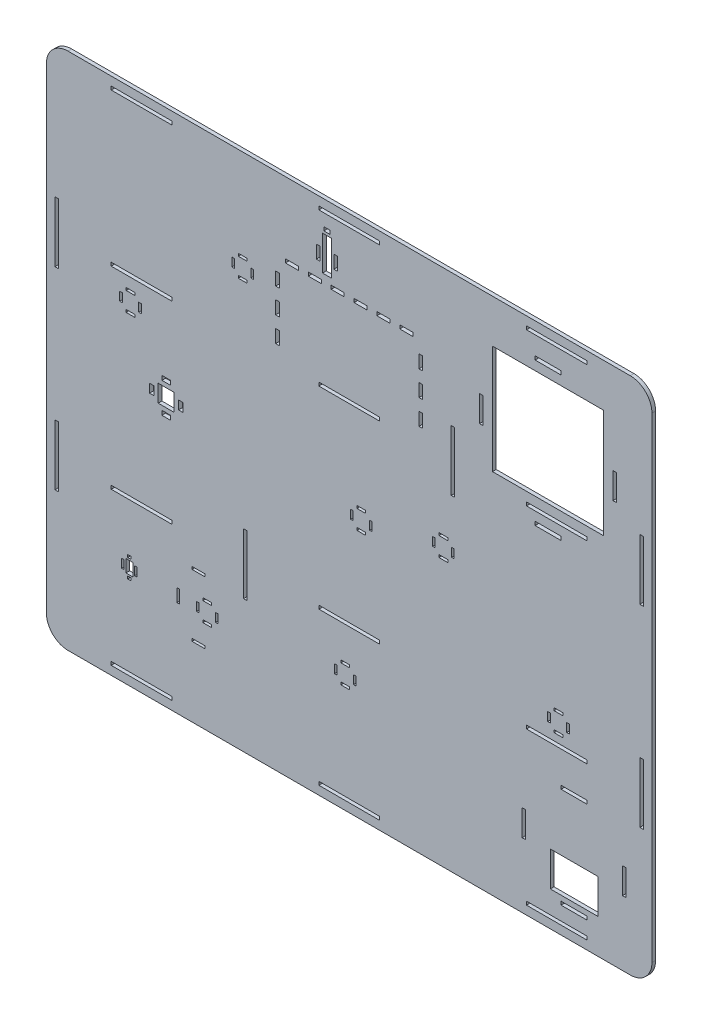
from build123d import *

# Parameters (mm, degrees)
SKETCH1_W           = 4.2
SKETCH1_H           = 15.1
SKETCH1_W_2         = 70
SKETCH1_H_2         = 4
SKETCH1_W_3         = 4
SKETCH1_H_3         = 70
SKETCH1_W_4         = 15.1
SKETCH1_H_4         = 4.2
SKETCH1_W_5         = 7.1
SKETCH1_W_6         = 10.1
SKETCH1_H_5         = 40
SKETCH1_W_7         = 30
SKETCH1_H_6         = 30
SKETCH1_W_8         = 55
SKETCH1_W_9         = 3
SKETCH1_H_7         = 10
SKETCH1_H_8         = 3
SKETCH1_W_10        = 5
SKETCH1_W_11        = 10
SKETCH1_H_9         = 5
SKETCH1_W_12        = 18.5
SKETCH1_H_10        = 20
SKETCH1_W_13        = 8
SKETCH1_H_11        = 14.5
SKETCH1_W_14        = 15
SKETCH1_H_12        = 15
SKETCH1_W_15        = 4.3
SKETCH1_H_13        = 30.1
SKETCH1_W_16        = 30.1
SKETCH1_H_14        = 4.3
SKETCH1_W_17        = 128.6
SKETCH1_H_15        = 125.6333
BOSS_EXTRUDE1_DEPTH = 4.3


with BuildPart() as part:
    # Sketch1 → Boss-Extrude1 (new body)
    with BuildSketch(Plane.XY):
        with BuildLine():
            Line((-325, -300), (325, -300))
            ThreePointArc((325, -300), (342.67766953, -292.67766953), (350, -275))
            Line((350, -275), (350, 275))
            ThreePointArc((350, 275), (342.67766953, 292.67766953), (325, 300))
            Line((325, 300), (-325, 300))
            ThreePointArc((-325, 300), (-342.67766953, 292.67766953), (-350, 275))
            Line((-350, 275), (-350, -275))
            ThreePointArc((-350, -275), (-342.67766953, -292.67766953), (-325, -300))
        make_face()
        with Locations((82.85, 192.32)):
            Rectangle(SKETCH1_W, SKETCH1_H, mode=Mode.SUBTRACT)
        with Locations((-240, -288)):
            Rectangle(SKETCH1_W_2, SKETCH1_H_2, mode=Mode.SUBTRACT)
        with Locations((338, -111.6666)):
            Rectangle(SKETCH1_W_3, SKETCH1_H_3, mode=Mode.SUBTRACT)
        with Locations((338, 111.6667)):
            Rectangle(SKETCH1_W_3, SKETCH1_H_3, mode=Mode.SUBTRACT)
        with Locations((0, -288)):
            Rectangle(SKETCH1_W_2, SKETCH1_H_2, mode=Mode.SUBTRACT)
        with Locations((240, -288)):
            Rectangle(SKETCH1_W_2, SKETCH1_H_2, mode=Mode.SUBTRACT)
        with Locations((-338, 111.6667)):
            Rectangle(SKETCH1_W_3, SKETCH1_H_3, mode=Mode.SUBTRACT)
        with Locations((-338, -111.6666)):
            Rectangle(SKETCH1_W_3, SKETCH1_H_3, mode=Mode.SUBTRACT)
        with Locations((120, 111.6667)):
            Rectangle(SKETCH1_W_3, SKETCH1_H_3, mode=Mode.SUBTRACT)
        with Locations((-120, -111.6667)):
            Rectangle(SKETCH1_W_3, SKETCH1_H_3, mode=Mode.SUBTRACT)
        with Locations((0, 111.6667)):
            Rectangle(SKETCH1_W_2, SKETCH1_H_2, mode=Mode.SUBTRACT)
        with Locations((-240, 111.6667)):
            Rectangle(SKETCH1_W_2, SKETCH1_H_2, mode=Mode.SUBTRACT)
        with Locations((240, 111.6667)):
            Rectangle(SKETCH1_W_2, SKETCH1_H_2, mode=Mode.SUBTRACT)
        with Locations((-240, -111.6667)):
            Rectangle(SKETCH1_W_2, SKETCH1_H_2, mode=Mode.SUBTRACT)
        with Locations((0, -111.6667)):
            Rectangle(SKETCH1_W_2, SKETCH1_H_2, mode=Mode.SUBTRACT)
        with Locations((240, -111.6667)):
            Rectangle(SKETCH1_W_2, SKETCH1_H_2, mode=Mode.SUBTRACT)
        with Locations((-240, 288)):
            Rectangle(SKETCH1_W_2, SKETCH1_H_2, mode=Mode.SUBTRACT)
        with Locations((0, 288)):
            Rectangle(SKETCH1_W_2, SKETCH1_H_2, mode=Mode.SUBTRACT)
        with Locations((240, 288)):
            Rectangle(SKETCH1_W_2, SKETCH1_H_2, mode=Mode.SUBTRACT)
        with Locations((82.85, 163.54)):
            Rectangle(SKETCH1_W, SKETCH1_H, mode=Mode.SUBTRACT)
        with Locations((82.85, 134.76)):
            Rectangle(SKETCH1_W, SKETCH1_H, mode=Mode.SUBTRACT)
        with Locations((-82.85, 134.76)):
            Rectangle(SKETCH1_W, SKETCH1_H, mode=Mode.SUBTRACT)
        with Locations((-82.85, 163.54)):
            Rectangle(SKETCH1_W, SKETCH1_H, mode=Mode.SUBTRACT)
        with Locations((-82.85, 192.32)):
            Rectangle(SKETCH1_W, SKETCH1_H, mode=Mode.SUBTRACT)
        with Locations((-66.1, 215.7)):
            Rectangle(SKETCH1_W_4, SKETCH1_H_4, mode=Mode.SUBTRACT)
        with Locations((-39.66, 215.7)):
            Rectangle(SKETCH1_W_4, SKETCH1_H_4, mode=Mode.SUBTRACT)
        with Locations((-13.22, 215.7)):
            Rectangle(SKETCH1_W_4, SKETCH1_H_4, mode=Mode.SUBTRACT)
        with Locations((13.22, 215.7)):
            Rectangle(SKETCH1_W_4, SKETCH1_H_4, mode=Mode.SUBTRACT)
        with Locations((39.66, 215.7)):
            Rectangle(SKETCH1_W_4, SKETCH1_H_4, mode=Mode.SUBTRACT)
        with Locations((66.1, 215.7)):
            Rectangle(SKETCH1_W_4, SKETCH1_H_4, mode=Mode.SUBTRACT)
        with Locations((-15.55, 242.85)):
            Rectangle(SKETCH1_W, SKETCH1_H, mode=Mode.SUBTRACT)
        with Locations((-35.85, 242.85)):
            Rectangle(SKETCH1_W, SKETCH1_H, mode=Mode.SUBTRACT)
        with Locations((-25.7, 270)):
            Rectangle(SKETCH1_W_5, SKETCH1_H_4, mode=Mode.SUBTRACT)
        with Locations((-25.7, 244.9)):
            Rectangle(SKETCH1_W_6, SKETCH1_H_5, mode=Mode.SUBTRACT)
        with Locations((260, -268)):
            Rectangle(SKETCH1_W_7, SKETCH1_H_2, mode=Mode.SUBTRACT)
        with Locations((202, -210)):
            Rectangle(SKETCH1_W_3, SKETCH1_H_6, mode=Mode.SUBTRACT)
        with Locations((260, -152)):
            Rectangle(SKETCH1_W_7, SKETCH1_H_2, mode=Mode.SUBTRACT)
        with Locations((318, -210)):
            Rectangle(SKETCH1_W_3, SKETCH1_H_6, mode=Mode.SUBTRACT)
        with Locations((260, -240)):
            Rectangle(SKETCH1_W_8, SKETCH1_H_5, mode=Mode.SUBTRACT)
        with Locations((-246.5, -181.7)):
            Rectangle(SKETCH1_W_9, SKETCH1_H_7, mode=Mode.SUBTRACT)
        with Locations((-254, -192.45)):
            Rectangle(SKETCH1_W_3, SKETCH1_H_8, mode=Mode.SUBTRACT)
        with Locations((-261.5, -181.7)):
            Rectangle(SKETCH1_W_9, SKETCH1_H_7, mode=Mode.SUBTRACT)
        with Locations((-254, -170.95)):
            Rectangle(SKETCH1_W_3, SKETCH1_H_8, mode=Mode.SUBTRACT)
        with Locations((-194.7, 9.66)):
            Rectangle(SKETCH1_W_10, SKETCH1_H_7, mode=Mode.SUBTRACT)
        with Locations((-228.2, 9.66)):
            Rectangle(SKETCH1_W_10, SKETCH1_H_7, mode=Mode.SUBTRACT)
        with Locations((-211.45, -7.84)):
            Rectangle(SKETCH1_W_11, SKETCH1_H_9, mode=Mode.SUBTRACT)
        with Locations((-211.45, 27.16)):
            Rectangle(SKETCH1_W_11, SKETCH1_H_9, mode=Mode.SUBTRACT)
        with Locations((-211.45, 9.66)):
            Rectangle(SKETCH1_W_12, SKETCH1_H_10, mode=Mode.SUBTRACT)
        with Locations((-254, -181.7)):
            Rectangle(SKETCH1_W_13, SKETCH1_H_11, mode=Mode.SUBTRACT)
        with Locations((-174, -217.7)):
            Rectangle(SKETCH1_W_14, SKETCH1_H_8, mode=Mode.SUBTRACT)
        with Locations((-174, -145.7)):
            Rectangle(SKETCH1_W_14, SKETCH1_H_8, mode=Mode.SUBTRACT)
        with Locations((-197.5, -181.7)):
            Rectangle(SKETCH1_W_9, SKETCH1_H_12, mode=Mode.SUBTRACT)
        with Locations((-164, -170.7)):
            Rectangle(SKETCH1_W_11, SKETCH1_H_8, mode=Mode.SUBTRACT)
        with Locations((-153, -181.7)):
            Rectangle(SKETCH1_W_9, SKETCH1_H_7, mode=Mode.SUBTRACT)
        with Locations((-164, -192.7)):
            Rectangle(SKETCH1_W_11, SKETCH1_H_8, mode=Mode.SUBTRACT)
        with Locations((-175, -181.7)):
            Rectangle(SKETCH1_W_9, SKETCH1_H_7, mode=Mode.SUBTRACT)
        with Locations((14.15, 10.6667)):
            Rectangle(SKETCH1_W_11, SKETCH1_H_8, mode=Mode.SUBTRACT)
        with Locations((25.15, -0.3333)):
            Rectangle(SKETCH1_W_9, SKETCH1_H_7, mode=Mode.SUBTRACT)
        with Locations((14.15, -11.3333)):
            Rectangle(SKETCH1_W_11, SKETCH1_H_8, mode=Mode.SUBTRACT)
        with Locations((3.15, -0.3333)):
            Rectangle(SKETCH1_W_9, SKETCH1_H_7, mode=Mode.SUBTRACT)
        with Locations((-15.5, -164.2)):
            Rectangle(SKETCH1_W_9, SKETCH1_H_7, mode=Mode.SUBTRACT)
        with Locations((-4.5, -153.2)):
            Rectangle(SKETCH1_W_11, SKETCH1_H_8, mode=Mode.SUBTRACT)
        with Locations((6.5, -164.2)):
            Rectangle(SKETCH1_W_9, SKETCH1_H_7, mode=Mode.SUBTRACT)
        with Locations((-4.5, -175.2)):
            Rectangle(SKETCH1_W_11, SKETCH1_H_8, mode=Mode.SUBTRACT)
        with Locations((98, 19.910000008)):
            Rectangle(SKETCH1_W_9, SKETCH1_H_7, mode=Mode.SUBTRACT)
        with Locations((120, 19.910000008)):
            Rectangle(SKETCH1_W_9, SKETCH1_H_7, mode=Mode.SUBTRACT)
        with Locations((109, 30.910000008)):
            Rectangle(SKETCH1_W_11, SKETCH1_H_8, mode=Mode.SUBTRACT)
        with Locations((109, 8.910000008)):
            Rectangle(SKETCH1_W_11, SKETCH1_H_8, mode=Mode.SUBTRACT)
        with Locations((231, -88.868252139)):
            Rectangle(SKETCH1_W_9, SKETCH1_H_7, mode=Mode.SUBTRACT)
        with Locations((253, -88.868252139)):
            Rectangle(SKETCH1_W_9, SKETCH1_H_7, mode=Mode.SUBTRACT)
        with Locations((242, -77.868252139)):
            Rectangle(SKETCH1_W_11, SKETCH1_H_8, mode=Mode.SUBTRACT)
        with Locations((242, -99.868252139)):
            Rectangle(SKETCH1_W_11, SKETCH1_H_8, mode=Mode.SUBTRACT)
        with Locations((-263.747423257, 84.48256313)):
            Rectangle(SKETCH1_W_9, SKETCH1_H_7, mode=Mode.SUBTRACT)
        with Locations((-241.747423257, 84.48256313)):
            Rectangle(SKETCH1_W_9, SKETCH1_H_7, mode=Mode.SUBTRACT)
        with Locations((-252.747423257, 95.48256313)):
            Rectangle(SKETCH1_W_11, SKETCH1_H_8, mode=Mode.SUBTRACT)
        with Locations((-252.747423257, 73.48256313)):
            Rectangle(SKETCH1_W_11, SKETCH1_H_8, mode=Mode.SUBTRACT)
        with Locations((-134.049006692, 183.561421431)):
            Rectangle(SKETCH1_W_9, SKETCH1_H_7, mode=Mode.SUBTRACT)
        with Locations((-112.049006692, 183.561421431)):
            Rectangle(SKETCH1_W_9, SKETCH1_H_7, mode=Mode.SUBTRACT)
        with Locations((-123.049006692, 194.561421431)):
            Rectangle(SKETCH1_W_11, SKETCH1_H_8, mode=Mode.SUBTRACT)
        with Locations((-123.049006692, 172.561421431)):
            Rectangle(SKETCH1_W_11, SKETCH1_H_8, mode=Mode.SUBTRACT)
        with Locations((307.15, 180)):
            Rectangle(SKETCH1_W_15, SKETCH1_H_13, mode=Mode.SUBTRACT)
        with Locations((230, 97.15)):
            Rectangle(SKETCH1_W_16, SKETCH1_H_14, mode=Mode.SUBTRACT)
        with Locations((152.85, 180)):
            Rectangle(SKETCH1_W_15, SKETCH1_H_13, mode=Mode.SUBTRACT)
        with Locations((230, 262.85)):
            Rectangle(SKETCH1_W_16, SKETCH1_H_14, mode=Mode.SUBTRACT)
        with Locations((230, 187.18335)):
            Rectangle(SKETCH1_W_17, SKETCH1_H_15, mode=Mode.SUBTRACT)
    extrude(amount=BOSS_EXTRUDE1_DEPTH)


solid = part.part
